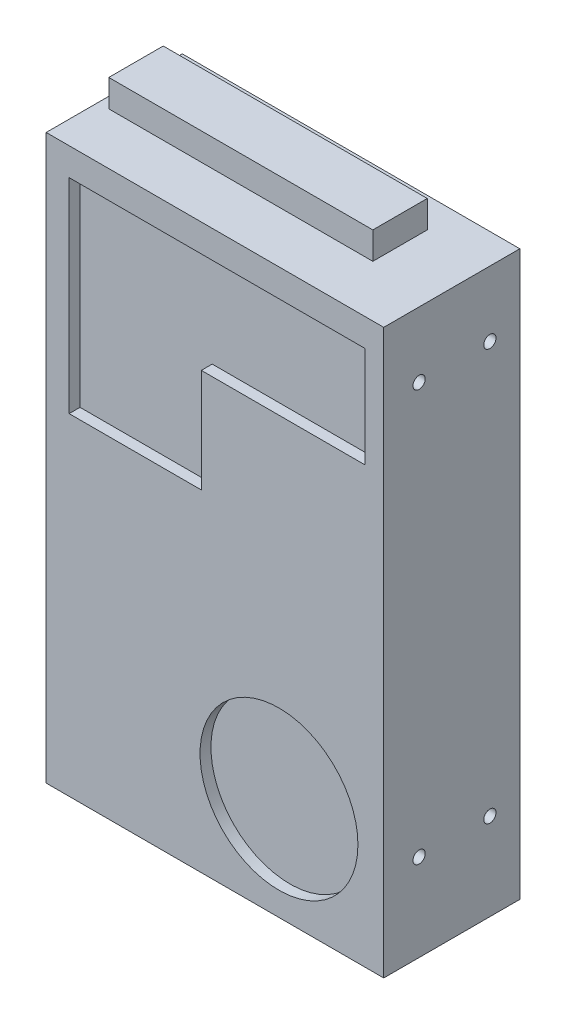
from build123d import *

# Parameters (mm, degrees)
SKETCH1_W           = 124
SKETCH1_H           = 225
BOSS_EXTRUDE1_DEPTH = 50
SKETCH2_W           = 142.142792237
SKETCH2_H           = 18
CUT_EXTRUDE1_DEPTH  = 50
SKETCH3_W           = 97
SKETCH3_H           = 20
BOSS_EXTRUDE2_DEPTH = 10
SKETCH4_R           = 29
CUT_EXTRUDE3_DEPTH  = 4
SKETCH5_R           = 2.25
CUT_EXTRUDE4_DEPTH  = 15
SKETCH6_R           = 2.25
CUT_EXTRUDE5_DEPTH  = 175.734799053


with BuildPart() as part:
    # Sketch1 → Boss-Extrude1 (new body)
    with BuildSketch(Plane.XY):
        Rectangle(SKETCH1_W, SKETCH1_H)
    extrude(amount=BOSS_EXTRUDE1_DEPTH)

    # Sketch2 → Cut-Extrude1 (cut)
    with BuildSketch(Plane.XY.offset(50)):
        with Locations((-0.947920956, 103.5)):
            Rectangle(SKETCH2_W, SKETCH2_H)
    extrude(amount=-CUT_EXTRUDE1_DEPTH, mode=Mode.SUBTRACT)

    # Sketch3 → Boss-Extrude2 (add)
    with BuildSketch(Plane(origin=(0, 94.5, 0), x_dir=(1, 0, 0), z_dir=(0, 1, 0))):
        with Locations((-9.5, -21)):
            Rectangle(SKETCH3_W, SKETCH3_H)
    extrude(amount=BOSS_EXTRUDE2_DEPTH)

    # Sketch4 → Cut-Extrude3 (cut)
    with BuildSketch(Plane.XY.offset(50)):
        with Locations((23.52502673, -74.82534643)):
            Circle(SKETCH4_R)
        Polygon((-53.556975746, 84.343983357), (55.058573197, 84.343983357), (55.058573197, 47.30457957), (-5.005324836, 47.30457957), (-5.005324836, 9.264110816), (-53.556975746, 9.264110816), align=None)
    extrude(amount=-CUT_EXTRUDE3_DEPTH, mode=Mode.SUBTRACT)

    # Sketch5 → Cut-Extrude4 (cut)
    with BuildSketch(Plane(origin=(0, 0, 0), x_dir=(-1, 0, 0), z_dir=(0, 0, -1))):
        with Locations((-25, 70.5)):
            Circle(SKETCH5_R)
        with Locations((25, 70.5)):
            Circle(SKETCH5_R)
        with Locations((25, -80.5)):
            Circle(SKETCH5_R)
        with Locations((-25, -80.5)):
            Circle(SKETCH5_R)
    extrude(amount=-CUT_EXTRUDE4_DEPTH, mode=Mode.SUBTRACT)

    # Sketch6 → Cut-Extrude5 (cut, through all)
    with BuildSketch(Plane.ZY.offset(62)):
        with Locations(Location((11, 70.5, 0), (0, 0, 270))):
            Circle(SKETCH6_R)
        with Locations(Location((37, 70.5, 0), (0, 0, 270))):
            Circle(SKETCH6_R)
        with Locations(Location((37, -80.5, 0), (0, 0, 270))):
            Circle(SKETCH6_R)
        with Locations(Location((11, -80.5, 0), (0, 0, 270))):
            Circle(SKETCH6_R)
    extrude(amount=-CUT_EXTRUDE5_DEPTH, mode=Mode.SUBTRACT)


solid = part.part
